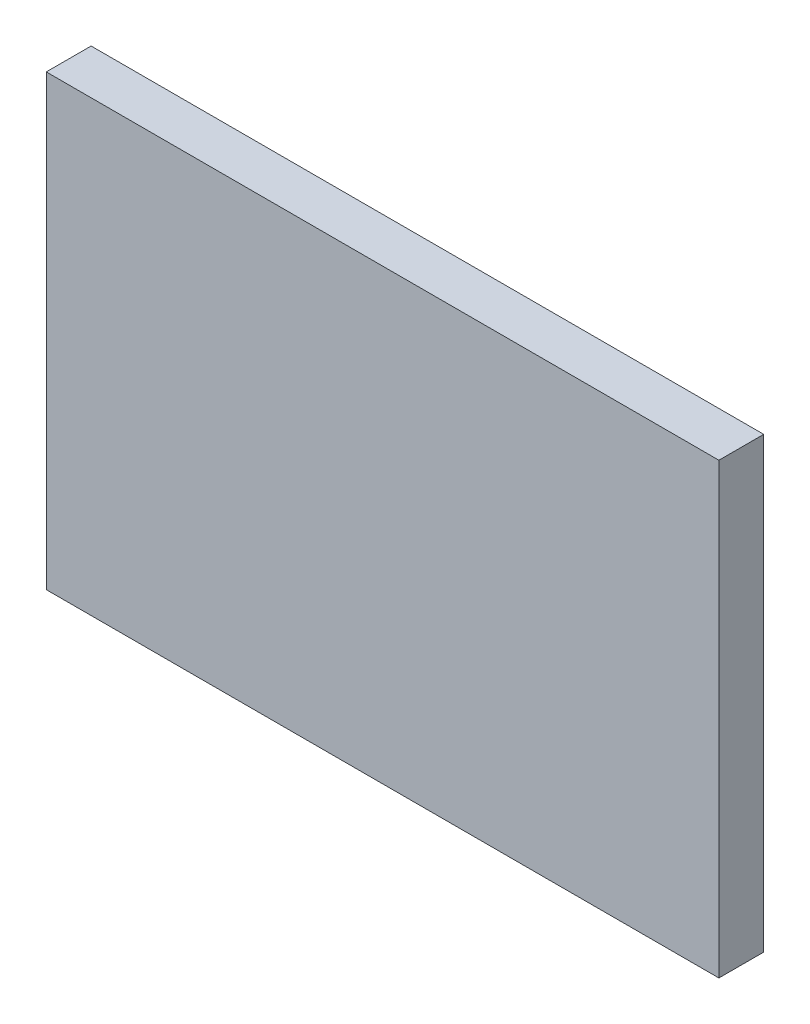
from build123d import *

# Parameters (mm, degrees)
SKETCH1_W           = 30
SKETCH1_H           = 20
BOSS_EXTRUDE1_DEPTH = 2


with BuildPart() as part:
    # Sketch1 → Boss-Extrude1 (new body)
    with BuildSketch(Plane.XY):
        with Locations((15, 10)):
            Rectangle(SKETCH1_W, SKETCH1_H)
    extrude(amount=BOSS_EXTRUDE1_DEPTH)


solid = part.part
